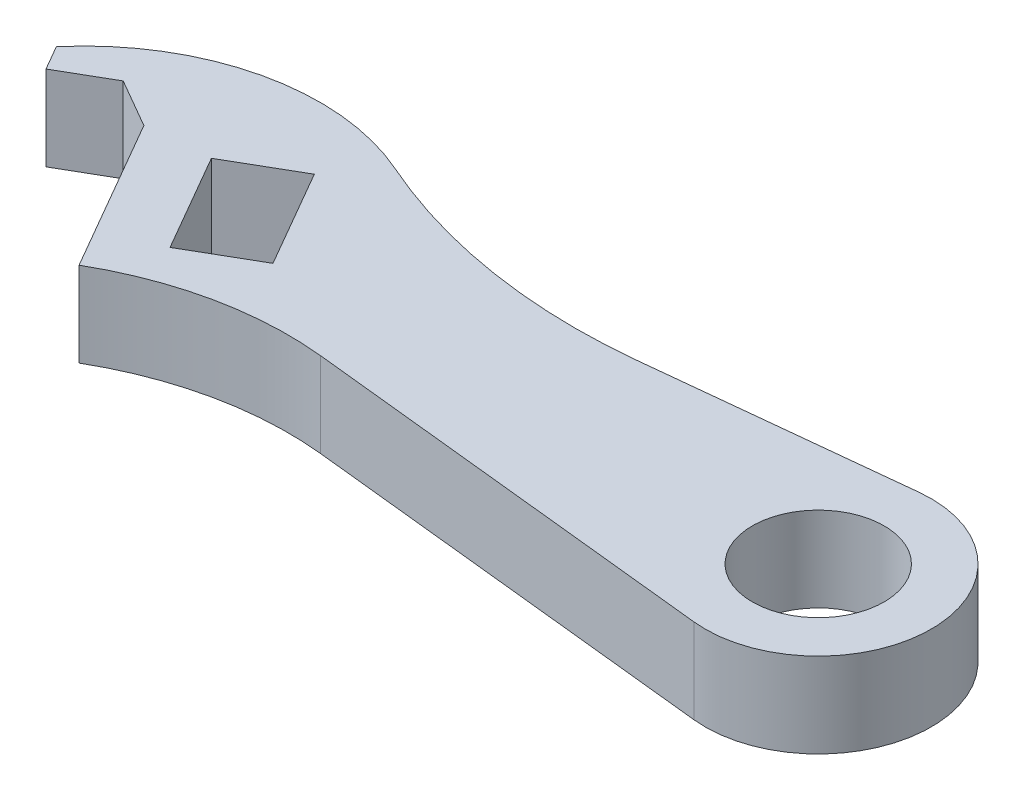
from build123d import *

# Parameters (mm, degrees)
SKETCH1_R           = 7
BOSS_EXTRUDE1_DEPTH = 4.5


with BuildPart() as part:
    # Sketch1 → Boss-Extrude1 (new, symmetric)
    with BuildSketch(Plane(origin=(0, 0, 0), x_dir=(1, 0, 0), z_dir=(0, 1, 0))):
        with BuildLine():
            Line((-1.254341559, 11.934262744), (-28.289662127, 9.092736051))
            ThreePointArc((-28.289662127, 9.092736051), (-43.850490966, 9.48747573), (-58.786122703, 13.871779345))
            ThreePointArc((-58.786122703, 13.871779345), (-74.520010862, 15.355444557), (-88, 7.106420865))
            Line((-88, 7.106420865), (-86.5, 4.508344654))
            Line((-86.5, 4.508344654), (-81.303847577, 7.508344654))
            Line((-81.303847577, 7.508344654), (-76.107695155, 4.508344654))
            Line((-76.107695155, 4.508344654), (-66.705771366, -11.776265037))
            ThreePointArc((-66.705771366, -11.776265037), (-56.482680545, -7.851988144), (-45.547275152, -7.278887832))
            Line((-45.547275152, -7.278887832), (-1.254341559, -11.934262744))
            ThreePointArc((-1.254341559, -11.934262744), (12, 0), (-1.254341559, 11.934262744))
        make_face()
        with Locations(Location((0, 0, 0), (0, 0, 270))):
            Circle(SKETCH1_R, mode=Mode.SUBTRACT)
        Polygon((-69.509618943, 5.080141424), (-63.509618943, -5.312163422), (-56.581415713, -1.312163422), (-62.581415713, 9.080141424), align=None, mode=Mode.SUBTRACT)
    extrude(amount=BOSS_EXTRUDE1_DEPTH, both=True)


solid = part.part
